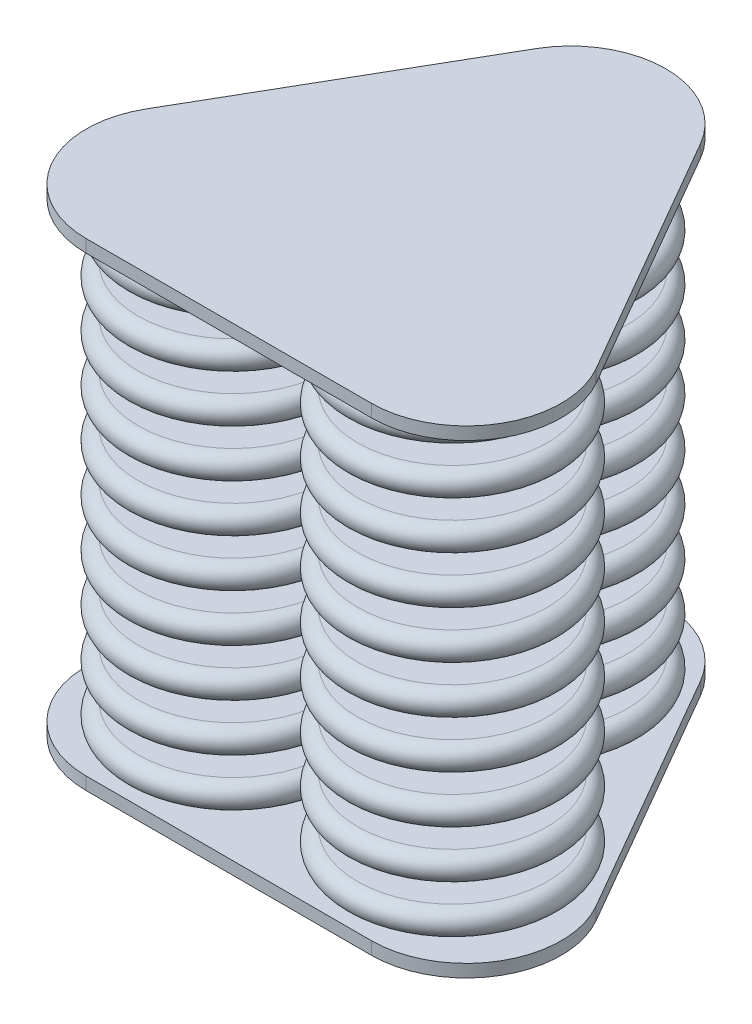
from build123d import *

# Parameters (mm, degrees)
SKETCH1_R           = 5
BOSS_EXTRUDE2_DEPTH = 2
LPATTERN1_COUNT     = 10
LPATTERN1_PITCH     = 7.5
BOSS_EXTRUDE3_DEPTH = 2


with BuildPart() as part:
    # Sweep1: sweep along a path in Sketch3
    with BuildLine(Plane(origin=(0, 0, 0), x_dir=(0, 0, -1), z_dir=(1, 0, 0))) as sweep1_path:
        Line((0, 0), (0, 70))
    # Sketch1 → Sweep1 (sweep)
    with BuildSketch(Plane(origin=(0, 0, 0), x_dir=(1, 0, 0), z_dir=(0, 1, 0))):
        with Locations((0, 20)):
            Circle(SKETCH1_R)
        with Locations((17.320508076, -10)):
            Circle(SKETCH1_R)
        with Locations((-17.320508076, -10)):
            Circle(SKETCH1_R)
    sweep(path=sweep1_path.line)

    # Sketch4 → Revolve1 (revolve)
    with BuildSketch(Plane(origin=(0, 0, 0), x_dir=(0, 0, -1), z_dir=(1, 0, 0)), mode=Mode.PRIVATE) as revolve1_sk:
        with BuildLine():
            Line((20, 4), (35, 4))
            ThreePointArc((35, 4), (37, 2), (35, 0))
            Line((35, 0), (20, 0))
            Line((20, 0), (20, 4))
        make_face()
    revolve1 = revolve(revolve1_sk.sketch.rotate(Axis((0, 0, -20), (0, 1, 0)), 180), axis=Axis((0, 0, -20), (0, 1, 0)))

    # Sketch7 → Revolve2 (revolve)
    with BuildSketch(Plane(origin=(17.32, 0, 0), x_dir=(0, 0, -1), z_dir=(1, 0, 0))):
        with BuildLine():
            Line((-10, 0), (5, 0))
            ThreePointArc((5, 0), (7, 2), (5, 4))
            Line((5, 4), (-10, 4))
            Line((-10, 4), (-10, 0))
        make_face()
    revolve2 = revolve(axis=Axis((17.32, 0, 10), (0, 1, 0)))

    # Sketch8 → Revolve3 (revolve)
    with BuildSketch(Plane(origin=(-17.32, 0, 0), x_dir=(0, 0, -1), z_dir=(1, 0, 0)), mode=Mode.PRIVATE) as revolve3_sk:
        with BuildLine():
            Line((-10, 0), (-25, 0))
            ThreePointArc((-25, 0), (-27, 2), (-25, 4))
            Line((-25, 4), (-10, 4))
            Line((-10, 4), (-10, 0))
        make_face()
    revolve3 = revolve(revolve3_sk.sketch.rotate(Axis((-17.32, 0, 10), (0, 1, 0)), 180), axis=Axis((-17.32, 0, 10), (0, 1, 0)))

    # LPattern1: Revolve1, Revolve2, Revolve3 ×10
    with Locations(*[(0, i * LPATTERN1_PITCH, 0) for i in range(1, LPATTERN1_COUNT)]):
        add(revolve1)
        add(revolve2)
        add(revolve3)

    # Sketch13 → Boss-Extrude3 (add)
    with BuildSketch(Plane(origin=(0, 71.5, 0), x_dir=(1, 0, 0), z_dir=(0, 1, 0))):
        with BuildLine():
            Line((-12.990381057, 33.5), (-35.507041555, -5.5))
            ThreePointArc((-35.507041555, -5.5), (-35.507041555, -20.5), (-22.516660498, -28))
            Line((-22.516660498, -28), (22.516660498, -28))
            ThreePointArc((22.516660498, -28), (35.507041555, -20.5), (35.507041555, -5.5))
            Line((35.507041555, -5.5), (12.990381057, 33.5))
            ThreePointArc((12.990381057, 33.5), (0, 41), (-12.990381057, 33.5))
        make_face()
    extrude(amount=BOSS_EXTRUDE3_DEPTH)


with BuildPart() as body_2:
    # Sketch12 → Boss-Extrude2 (new body)
    with BuildSketch(Plane.XZ):
        with BuildLine():
            Line((22.516660498, 28), (-22.516660498, 28))
            ThreePointArc((-22.516660498, 28), (-35.507041555, 20.5), (-35.507041555, 5.5))
            Line((-35.507041555, 5.5), (-12.990381057, -33.5))
            ThreePointArc((-12.990381057, -33.5), (0, -41), (12.990381057, -33.5))
            Line((12.990381057, -33.5), (35.507041555, 5.5))
            ThreePointArc((35.507041555, 5.5), (35.507041555, 20.5), (22.516660498, 28))
        make_face()
    extrude(amount=BOSS_EXTRUDE2_DEPTH)


solid = Compound([part.part, body_2.part])
